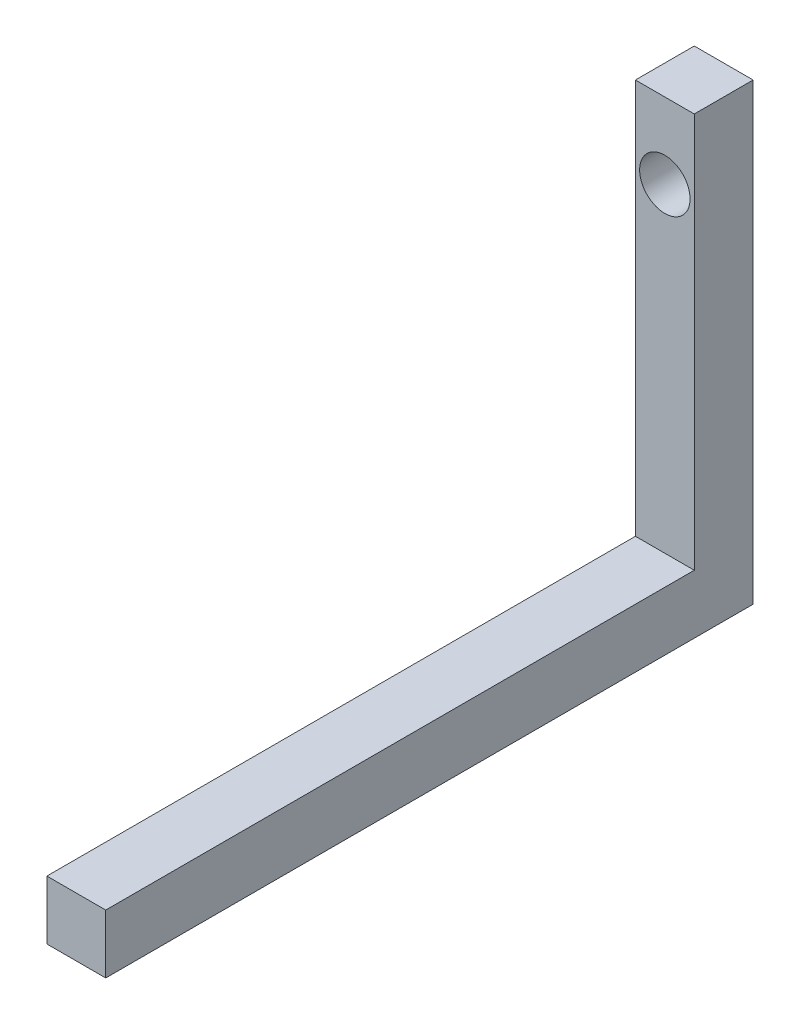
from build123d import *

# Parameters (mm, degrees)
CROQUIS1_W              = 35
CROQUIS1_H              = 35
SALIENTE_EXTRUIR1_DEPTH = 385
CROQUIS2_W              = 35
CROQUIS2_H              = 35
SALIENTE_EXTRUIR2_DEPTH = 235
CROQUIS3_R              = 15
CORTAR_EXTRUIR1_DEPTH   = 35


with BuildPart() as part:
    # Croquis1 → Saliente-Extruir1 (new body)
    with BuildSketch(Plane.XY):
        Rectangle(CROQUIS1_W, CROQUIS1_H)
    extrude(amount=SALIENTE_EXTRUIR1_DEPTH)

    # Croquis2 → Saliente-Extruir2 (add)
    with BuildSketch(Plane(origin=(0, 17.5, 0), x_dir=(1, 0, 0), z_dir=(0, 1, 0))):
        with Locations((0, -17.5)):
            Rectangle(CROQUIS2_W, CROQUIS2_H)
    extrude(amount=SALIENTE_EXTRUIR2_DEPTH)

    # Croquis3 → Cortar-Extruir1 (cut)
    with BuildSketch(Plane(origin=(0, 0, 0), x_dir=(-1, 0, 0), z_dir=(0, 0, -1))):
        with Locations((0, 207.5)):
            Circle(CROQUIS3_R)
    extrude(amount=-CORTAR_EXTRUIR1_DEPTH, mode=Mode.SUBTRACT)


solid = part.part
